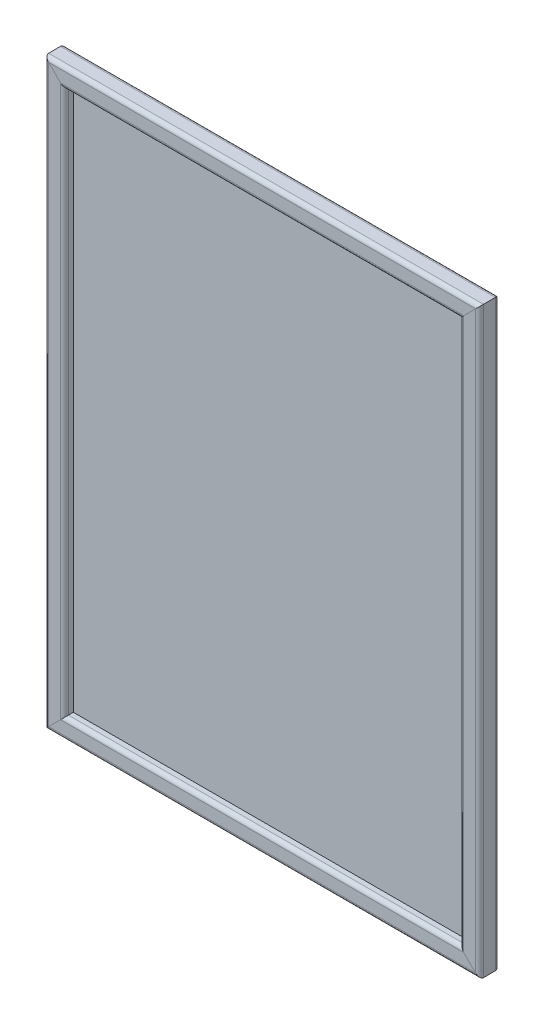
from build123d import *

# Parameters (mm, degrees)
RURA_KWADRATOWA_20_X_20_X_2_1_DEPTH      = 585.142135624
RURA_KWADRATOWA_20_X_20_X_2_1_DEPTH_BACK = 15.142135624
RURA_KWADRATOWA_20_X_20_X_2_1_2_DEPTH    = 450.284271247
RURA_KWADRATOWA_20_X_20_X_2_1_3_DEPTH    = 600.284271247
RURA_KWADRATOWA_20_X_20_X_2_1_4_DEPTH    = 450.284271247
DODANIE_WYCI_GNI_CIE1_DEPTH              = 1
DODANIE_WYCI_GNI_CIE1_DEPTH_BACK         = 1
SZKIC9_W                                 = 400
SZKIC9_H                                 = 550


with BuildPart() as part:
    # Sketch1 → Rura kwadratowa 20 X 20 X 2(1) (new, two sides: drawn at the far end of the back side and taken through both)
    with BuildSketch(Plane(origin=(0, 0, 0), x_dir=(1, 0, 0), z_dir=(0, 1, 0)).offset(-RURA_KWADRATOWA_20_X_20_X_2_1_DEPTH_BACK)):
        with BuildLine():
            Line((-6, -10), (6, -10))
            ThreePointArc((6, -10), (8.828427125, -8.828427125), (10, -6))
            Line((10, -6), (10, 6))
            ThreePointArc((10, 6), (8.828427125, 8.828427125), (6, 10))
            Line((6, 10), (-6, 10))
            ThreePointArc((-6, 10), (-8.828427125, 8.828427125), (-10, 6))
            Line((-10, 6), (-10, -6))
            ThreePointArc((-10, -6), (-8.828427125, -8.828427125), (-6, -10))
        make_face()
        with BuildLine():
            Line((-6, -8), (6, -8))
            ThreePointArc((6, -8), (7.414213562, -7.414213562), (8, -6))
            Line((8, -6), (8, 6))
            ThreePointArc((8, 6), (7.414213562, 7.414213562), (6, 8))
            Line((6, 8), (-6, 8))
            ThreePointArc((-6, 8), (-7.414213562, 7.414213562), (-8, 6))
            Line((-8, 6), (-8, -6))
            ThreePointArc((-8, -6), (-7.414213562, -7.414213562), (-6, -8))
        make_face(mode=Mode.SUBTRACT)
    extrude(amount=RURA_KWADRATOWA_20_X_20_X_2_1_DEPTH + RURA_KWADRATOWA_20_X_20_X_2_1_DEPTH_BACK)

    # Rura kwadratowa 20 X 20 X 2(1) mitre 1
    split(bisect_by=Plane(origin=(0, 0, 0), x_dir=(-0.707106781, -0.707106781, 0), z_dir=(-0.707106781, 0.707106781, 0)), keep=Keep.TOP)

    # Rura kwadratowa 20 X 20 X 2(1) mitre 2
    split(bisect_by=Plane(origin=(0, 570, 0), x_dir=(0.707106781, -0.707106781, 0), z_dir=(-0.707106781, -0.707106781, 0)), keep=Keep.TOP)


with BuildPart() as body_2:
    # Sketch1 on segment 2 (carried to segment 2) → Rura kwadratowa 20 X 20 X 2_1 2 (new body)
    with BuildSketch(Plane(origin=(-15.142135624, 570, 0), x_dir=(0, -1, 0), z_dir=(1, 0, 0))):
        with BuildLine():
            Line((-6, -10), (6, -10))
            ThreePointArc((6, -10), (8.828427125, -8.828427125), (10, -6))
            Line((10, -6), (10, 6))
            ThreePointArc((10, 6), (8.828427125, 8.828427125), (6, 10))
            Line((6, 10), (-6, 10))
            ThreePointArc((-6, 10), (-8.828427125, 8.828427125), (-10, 6))
            Line((-10, 6), (-10, -6))
            ThreePointArc((-10, -6), (-8.828427125, -8.828427125), (-6, -10))
        make_face()
        with BuildLine():
            Line((-6, -8), (6, -8))
            ThreePointArc((6, -8), (7.414213562, -7.414213562), (8, -6))
            Line((8, -6), (8, 6))
            ThreePointArc((8, 6), (7.414213562, 7.414213562), (6, 8))
            Line((6, 8), (-6, 8))
            ThreePointArc((-6, 8), (-7.414213562, 7.414213562), (-8, 6))
            Line((-8, 6), (-8, -6))
            ThreePointArc((-8, -6), (-7.414213562, -7.414213562), (-6, -8))
        make_face(mode=Mode.SUBTRACT)
    extrude(amount=RURA_KWADRATOWA_20_X_20_X_2_1_2_DEPTH)

    # Rura kwadratowa 20 X 20 X 2_1 2 mitre 1
    split(bisect_by=Plane(origin=(0, 570, 0), x_dir=(-0.707106781, 0.707106781, 0), z_dir=(0.707106781, 0.707106781, 0)), keep=Keep.TOP)

    # Rura kwadratowa 20 X 20 X 2_1 2 mitre 2
    split(bisect_by=Plane(origin=(420, 570, 0), x_dir=(-0.707106781, -0.707106781, 0), z_dir=(-0.707106781, 0.707106781, 0)), keep=Keep.TOP)


with BuildPart() as body_3:
    # Sketch1 on segment 3 (carried to segment 3) → Rura kwadratowa 20 X 20 X 2_1 3 (new body)
    with BuildSketch(Plane(origin=(420, 585.142135624, 0), x_dir=(-1, 0, 0), z_dir=(0, -1, 0))):
        with BuildLine():
            Line((-6, -10), (6, -10))
            ThreePointArc((6, -10), (8.828427125, -8.828427125), (10, -6))
            Line((10, -6), (10, 6))
            ThreePointArc((10, 6), (8.828427125, 8.828427125), (6, 10))
            Line((6, 10), (-6, 10))
            ThreePointArc((-6, 10), (-8.828427125, 8.828427125), (-10, 6))
            Line((-10, 6), (-10, -6))
            ThreePointArc((-10, -6), (-8.828427125, -8.828427125), (-6, -10))
        make_face()
        with BuildLine():
            Line((-6, -8), (6, -8))
            ThreePointArc((6, -8), (7.414213562, -7.414213562), (8, -6))
            Line((8, -6), (8, 6))
            ThreePointArc((8, 6), (7.414213562, 7.414213562), (6, 8))
            Line((6, 8), (-6, 8))
            ThreePointArc((-6, 8), (-7.414213562, 7.414213562), (-8, 6))
            Line((-8, 6), (-8, -6))
            ThreePointArc((-8, -6), (-7.414213562, -7.414213562), (-6, -8))
        make_face(mode=Mode.SUBTRACT)
    extrude(amount=RURA_KWADRATOWA_20_X_20_X_2_1_3_DEPTH)

    # Rura kwadratowa 20 X 20 X 2_1 3 mitre 1
    split(bisect_by=Plane(origin=(420, 0, 0), x_dir=(-0.707106781, 0.707106781, 0), z_dir=(0.707106781, 0.707106781, 0)), keep=Keep.TOP)

    # Rura kwadratowa 20 X 20 X 2_1 3 mitre 2
    split(bisect_by=Plane(origin=(420, 570, 0), x_dir=(0.707106781, 0.707106781, 0), z_dir=(0.707106781, -0.707106781, 0)), keep=Keep.TOP)


with BuildPart() as body_4:
    # Sketch1 on segment 4 (carried to segment 4) → Rura kwadratowa 20 X 20 X 2_1 4 (new body)
    with BuildSketch(Plane(origin=(435.142135624, 0, 0), x_dir=(0, 1, 0), z_dir=(-1, 0, 0))):
        with BuildLine():
            Line((-6, -10), (6, -10))
            ThreePointArc((6, -10), (8.828427125, -8.828427125), (10, -6))
            Line((10, -6), (10, 6))
            ThreePointArc((10, 6), (8.828427125, 8.828427125), (6, 10))
            Line((6, 10), (-6, 10))
            ThreePointArc((-6, 10), (-8.828427125, 8.828427125), (-10, 6))
            Line((-10, 6), (-10, -6))
            ThreePointArc((-10, -6), (-8.828427125, -8.828427125), (-6, -10))
        make_face()
        with BuildLine():
            Line((-6, -8), (6, -8))
            ThreePointArc((6, -8), (7.414213562, -7.414213562), (8, -6))
            Line((8, -6), (8, 6))
            ThreePointArc((8, 6), (7.414213562, 7.414213562), (6, 8))
            Line((6, 8), (-6, 8))
            ThreePointArc((-6, 8), (-7.414213562, 7.414213562), (-8, 6))
            Line((-8, 6), (-8, -6))
            ThreePointArc((-8, -6), (-7.414213562, -7.414213562), (-6, -8))
        make_face(mode=Mode.SUBTRACT)
    extrude(amount=RURA_KWADRATOWA_20_X_20_X_2_1_4_DEPTH)

    # Rura kwadratowa 20 X 20 X 2_1 4 mitre 1
    split(bisect_by=Plane(origin=(0, 0, 0), x_dir=(0.707106781, 0.707106781, 0), z_dir=(0.707106781, -0.707106781, 0)), keep=Keep.TOP)

    # Rura kwadratowa 20 X 20 X 2_1 4 mitre 2
    split(bisect_by=Plane(origin=(420, 0, 0), x_dir=(0.707106781, -0.707106781, 0), z_dir=(-0.707106781, -0.707106781, 0)), keep=Keep.TOP)


with BuildPart() as body_5:
    # Szkic9 → Dodanie-wyciągnięcie1 (new, two sides: drawn at the far end of the back side and taken through both)
    with BuildSketch(Plane.XY.offset(-DODANIE_WYCI_GNI_CIE1_DEPTH_BACK)):
        with Locations((210, 285)):
            Rectangle(SZKIC9_W, SZKIC9_H)
    extrude(amount=DODANIE_WYCI_GNI_CIE1_DEPTH + DODANIE_WYCI_GNI_CIE1_DEPTH_BACK)


solid = Compound([part.part, body_2.part, body_3.part, body_4.part, body_5.part])
